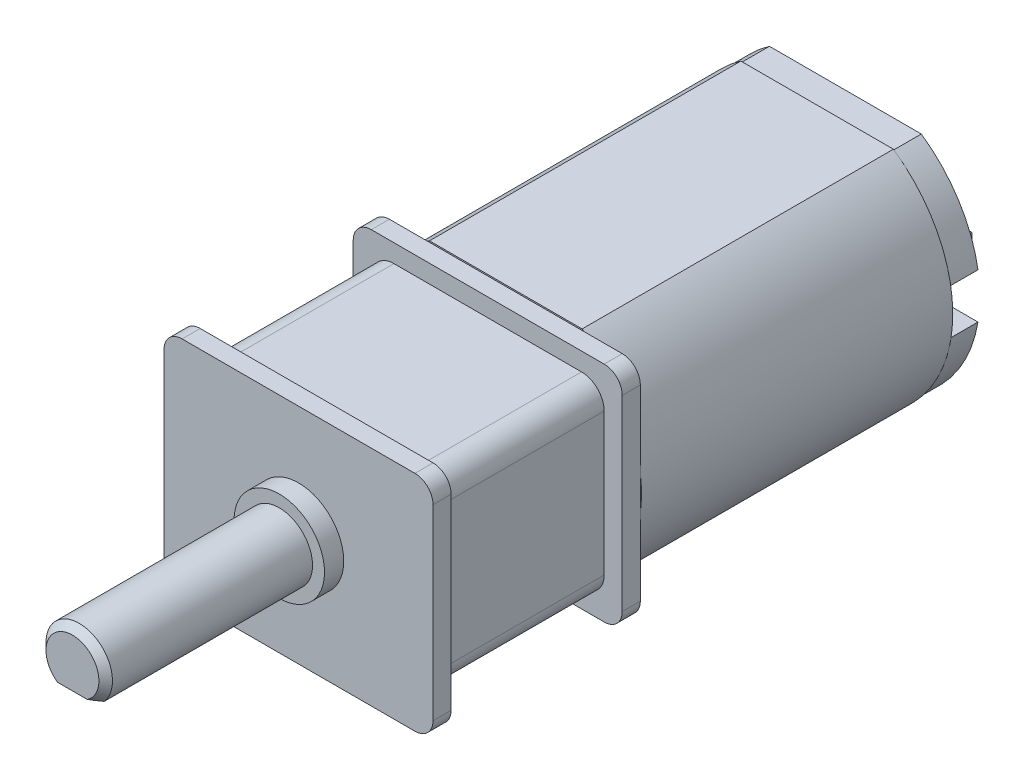
from build123d import *

# Parameters (mm, degrees)
BOSS_EXTRUDE1_DEPTH = 16.82
BOSS_EXTRUDE2_DEPTH = 9.17
SKETCH3_R           = 2
BOSS_EXTRUDE3_DEPTH = 0.85
SKETCH4_R           = 1.47
BOSS_EXTRUDE4_DEPTH = 9.15
CUT_EXTRUDE1_DEPTH  = 9.15
SKETCH7_R           = 7.076677912
SKETCH7_R_2         = 2.5
CUT_EXTRUDE2_DEPTH  = 1.8
SKETCH8_R           = 2.5
CUT_EXTRUDE3_DEPTH  = 0.55
SKETCH9_W           = 14.3
SKETCH9_H           = 12.28
SKETCH9_W_2         = 10.3
SKETCH9_H_2         = 8.28
CUT_EXTRUDE4_DEPTH  = 7.57
FILLET1_R           = 1
CHAMFER2_SIZE       = 0.25
SKETCH10_R          = 0.35
CUT_EXTRUDE5_DEPTH  = 0.8
SKETCH11_R          = 0.35
CUT_EXTRUDE6_DEPTH  = 0.8
FILLET2_R           = 0.2
SKETCH12_R          = 0.825
CUT_EXTRUDE7_DEPTH  = 1
CUT_EXTRUDE8_DEPTH  = 1.25
SKETCH14_W          = 1.939968983
SKETCH14_H          = 2
CUT_EXTRUDE9_DEPTH  = 1.25
CHAMFER3_SIZE       = 0.3


with BuildPart() as part:
    # Sketch1 → Boss-Extrude1 (new body)
    with BuildSketch(Plane.XY):
        with BuildLine():
            Line((53.676749567, -74.893540286), (60.426749567, -74.893540286))
            ThreePointArc((60.426749567, -74.893540286), (63.051749567, -79.893540286), (60.426749567, -84.893540286))
            Line((60.426749567, -84.893540286), (53.676749567, -84.893540286))
            ThreePointArc((53.676749567, -84.893540286), (51.051749567, -79.893540286), (53.676749567, -74.893540286))
        make_face()
    extrude(amount=-BOSS_EXTRUDE1_DEPTH)

    # Sketch2 → Boss-Extrude2 (add)
    with BuildSketch(Plane.XY):
        with BuildLine():
            Line((63.001749567, -84.033540286), (63.001749567, -75.753540286))
            ThreePointArc((63.001749567, -75.753540286), (62.767434992, -75.187854862), (62.201749567, -74.953540286))
            Line((62.201749567, -74.953540286), (51.901749567, -74.953540286))
            ThreePointArc((51.901749567, -74.953540286), (51.336064142, -75.187854862), (51.101749567, -75.753540286))
            Line((51.101749567, -75.753540286), (51.101749567, -84.033540286))
            ThreePointArc((51.101749567, -84.033540286), (51.336064142, -84.599225711), (51.901749567, -84.833540286))
            Line((51.901749567, -84.833540286), (62.201749567, -84.833540286))
            ThreePointArc((62.201749567, -84.833540286), (62.767434992, -84.599225711), (63.001749567, -84.033540286))
        make_face()
    extrude(amount=BOSS_EXTRUDE2_DEPTH)

    # Sketch3 → Boss-Extrude3 (add)
    with BuildSketch(Plane.XY.offset(9.17)):
        with Locations((57.051749567, -79.893540286)):
            Circle(SKETCH3_R)
    extrude(amount=BOSS_EXTRUDE3_DEPTH)

    # Sketch4 → Boss-Extrude4 (add)
    with BuildSketch(Plane.XY.offset(10.02)):
        with Locations((57.051749567, -79.893540286)):
            Circle(SKETCH4_R)
    extrude(amount=BOSS_EXTRUDE4_DEPTH)

    # Sketch5 → Cut-Extrude1 (cut)
    with BuildSketch(Plane.XY.offset(19.17)):
        Polygon((57.051749567, -80.863540286), (58.479364881, -80.863540286), (58.479364881, -81.63553805), (55.371975477, -81.63553805), (55.371975477, -80.863540286), align=None)
    extrude(amount=-CUT_EXTRUDE1_DEPTH, mode=Mode.SUBTRACT)

    # Sketch7 → Cut-Extrude2 (cut)
    with BuildSketch(Plane(origin=(0, 0, -16.82), x_dir=(-1, 0, 0), z_dir=(0, 0, -1))):
        with Locations((-57.051749567, -79.893540286)):
            Circle(SKETCH7_R)
        with Locations((-57.051749567, -79.893540286)):
            Circle(SKETCH7_R_2, mode=Mode.SUBTRACT)
        Polygon((-60.551749567, -79.143540286), (-60.851749567, -79.143540286), (-60.851749567, -79.893540286), (-60.851749567, -80.643540286), (-60.551749567, -80.643540286), align=None, mode=Mode.SUBTRACT)
        Polygon((-53.251749567, -79.143540286), (-53.251749567, -79.893540286), (-53.251749567, -80.643540286), (-53.551749567, -80.643540286), (-53.551749567, -79.143540286), align=None, mode=Mode.SUBTRACT)
    extrude(amount=-CUT_EXTRUDE2_DEPTH, mode=Mode.SUBTRACT)

    # Sketch8 → Cut-Extrude3 (cut)
    with BuildSketch(Plane(origin=(0, 0, -16.82), x_dir=(-1, 0, 0), z_dir=(0, 0, -1))):
        with Locations((-57.051749567, -79.893540286)):
            Circle(SKETCH8_R)
    extrude(amount=-CUT_EXTRUDE3_DEPTH, mode=Mode.SUBTRACT)

    # Sketch9 → Cut-Extrude4 (cut)
    with BuildSketch(Plane.XY.offset(8.37)):
        with Locations((57.051749567, -79.893540286)):
            Rectangle(SKETCH9_W, SKETCH9_H)
        with Locations((57.051749567, -79.893540286)):
            Rectangle(SKETCH9_W_2, SKETCH9_H_2, mode=Mode.SUBTRACT)
    extrude(amount=-CUT_EXTRUDE4_DEPTH, mode=Mode.SUBTRACT)

    # Fillet1
    fillet1_edges = [part.edges().sort_by_distance(p)[0] for p in [
        (51.901749567, -75.753540286, 4.585),
        (51.901749567, -84.033540286, 4.585),
        (62.201749567, -84.033540286, 4.585),
        (62.201749567, -75.753540286, 4.585),
    ]]
    fillet(fillet1_edges, radius=FILLET1_R)

    # Chamfer2
    chamfer2_edges = [part.edges().sort_by_distance(p)[0] for p in [
        (60.701749567, -80.643540286, -16.82),
        (60.701749567, -79.143540286, -16.82),
        (53.401749567, -80.643540286, -16.82),
        (53.401749567, -79.143540286, -16.82),
    ]]
    chamfer(chamfer2_edges, length=CHAMFER2_SIZE)

    # Sketch10 → Cut-Extrude5 (cut)
    with BuildSketch(Plane(origin=(60.851749567, 0, 0), x_dir=(0, 0, -1), z_dir=(1, 0, 0))):
        with Locations((15.996548304, -79.893540286)):
            Circle(SKETCH10_R)
    extrude(amount=-CUT_EXTRUDE5_DEPTH, mode=Mode.SUBTRACT)

    # Sketch11 → Cut-Extrude6 (cut)
    with BuildSketch(Plane(origin=(53.551749567, 0, 0), x_dir=(0, 0, -1), z_dir=(1, 0, 0))):
        with Locations((15.996548304, -79.893540286)):
            Circle(SKETCH11_R)
    extrude(amount=-CUT_EXTRUDE6_DEPTH, mode=Mode.SUBTRACT)

    # Fillet2
    fillet2_edges = [part.edges().sort_by_distance(p)[0] for p in [
        (59.551749567, -79.893540286, -16.27),
    ]]
    fillet(fillet2_edges, radius=FILLET2_R)

    # Sketch12 → Cut-Extrude7 (cut)
    with BuildSketch(Plane(origin=(0, 0, -16.27), x_dir=(-1, 0, 0), z_dir=(0, 0, -1))):
        with Locations((-57.051749567, -79.893540286)):
            Circle(SKETCH12_R)
    extrude(amount=-CUT_EXTRUDE7_DEPTH, mode=Mode.SUBTRACT)

    # Sketch13 → Cut-Extrude8 (cut)
    with BuildSketch(Plane(origin=(0, 0, -15.02), x_dir=(-1, 0, 0), z_dir=(0, 0, -1))):
        with BuildLine():
            Line((-53.392555226, -73.943540286), (-60.710943907, -73.943540286))
            ThreePointArc((-60.710943907, -73.943540286), (-64.001749567, -79.893540286), (-60.710943907, -85.843540286))
            Line((-60.710943907, -85.843540286), (-53.392555226, -85.843540286))
            ThreePointArc((-53.392555226, -85.843540286), (-50.101749567, -79.893540286), (-53.392555226, -73.943540286))
        make_face()
        with BuildLine():
            Line((-53.692358654, -74.943540286), (-60.411140479, -74.943540286))
            ThreePointArc((-60.411140479, -74.943540286), (-63.001749567, -79.893540286), (-60.411140479, -84.843540286))
            Line((-60.411140479, -84.843540286), (-53.692358654, -84.843540286))
            ThreePointArc((-53.692358654, -84.843540286), (-51.101749567, -79.893540286), (-53.692358654, -74.943540286))
        make_face(mode=Mode.SUBTRACT)
    extrude(amount=-CUT_EXTRUDE8_DEPTH, mode=Mode.SUBTRACT)

    # Sketch14 → Cut-Extrude9 (cut)
    with BuildSketch(Plane(origin=(0, 0, -15.02), x_dir=(-1, 0, 0), z_dir=(0, 0, -1))):
        with Locations((-62.346150018, -79.893540286)):
            Rectangle(SKETCH14_W, SKETCH14_H)
        with Locations((-51.757349116, -79.893540286)):
            Rectangle(SKETCH14_W, SKETCH14_H)
    extrude(amount=-CUT_EXTRUDE9_DEPTH, mode=Mode.SUBTRACT)

    # Chamfer3
    chamfer3_edges = [part.edges().sort_by_distance(p)[0] for p in [
        (57.051749567, -78.423540286, 19.17),
    ]]
    chamfer(chamfer3_edges, length=CHAMFER3_SIZE)


solid = part.part
